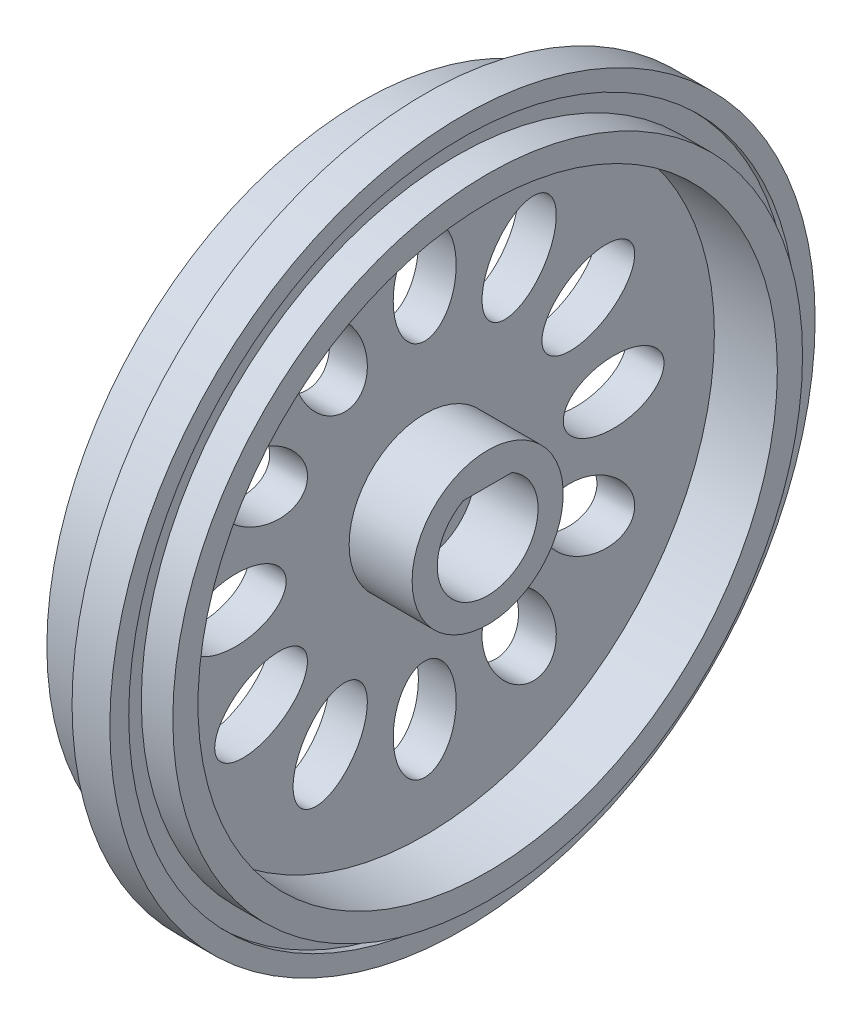
from build123d import *

# Parameters (mm, degrees)
SKETCH2_R           = 23
CUT_EXTRUDE1_DEPTH  = 5
CUT_EXTRUDE2_START  = -2
SKETCH3_R           = 23
CUT_EXTRUDE2_DEPTH  = 2
SKETCH4_R           = 6
BOSS_EXTRUDE2_DEPTH = 5
CUT_EXTRUDE3_DEPTH  = 5
SKETCH6_R           = 1.5
CUT_EXTRUDE4_DEPTH  = 3
SKETCH7_RX          = 4
SKETCH7_RY          = 2.5
CUT_EXTRUDE5_DEPTH  = 3
CIRPATTERN1_COUNT   = 12


with BuildPart() as part:
    # Sketch1 → Revolve1 (revolve)
    with BuildSketch(Plane(origin=(0, 0, 0), x_dir=(1, 0, 0), z_dir=(0, 1, 0)), mode=Mode.PRIVATE) as revolve1_sk:
        Polygon((-5, 25), (0.5, 25), (0.5, 26.5), (0, 26.5), (0, 28), (3, 28), (3, 26.5), (2.5, 26.5), (2.5, 25), (5, 25), (5, 0), (-5, 0), align=None)
    revolve(revolve1_sk.sketch.rotate(Axis((0, 0, 0), (1, 0, 0)), 180), axis=Axis((0, 0, 0), (1, 0, 0)))

    # Sketch2 → Cut-Extrude1 (cut)
    with BuildSketch(Plane(origin=(5, 0, 0), x_dir=(0, 0, -1), z_dir=(1, 0, 0))):
        Circle(SKETCH2_R)
    extrude(amount=-CUT_EXTRUDE1_DEPTH, mode=Mode.SUBTRACT)

    # Sketch3 → Cut-Extrude2 (cut)
    with BuildSketch(Plane.ZY.offset(5).offset(CUT_EXTRUDE2_START)):
        with Locations(Location((0, 0, 0), (0, 0, 180))):
            Circle(SKETCH3_R)
    extrude(amount=CUT_EXTRUDE2_DEPTH, mode=Mode.SUBTRACT)

    # Sketch4 → Boss-Extrude2 (add)
    with BuildSketch(Plane(origin=(0, 0, 0), x_dir=(0, 0, -1), z_dir=(1, 0, 0))):
        with Locations(Location((0, 0, 0), (0, 0, 180))):
            Circle(SKETCH4_R)
    extrude(amount=BOSS_EXTRUDE2_DEPTH)

    # Sketch5 → Cut-Extrude3 (cut)
    with BuildSketch(Plane(origin=(5, 0, 0), x_dir=(0, 0, -1), z_dir=(1, 0, 0))):
        with BuildLine():
            Line((-1.936491673, 3.5), (1.936491673, 3.5))
            ThreePointArc((1.936491673, 3.5), (0, -4), (-1.936491673, 3.5))
        make_face()
    extrude(amount=-CUT_EXTRUDE3_DEPTH, mode=Mode.SUBTRACT)

    # Sketch6 → Cut-Extrude4 (cut)
    with BuildSketch(Plane.ZY.offset(3)):
        Circle(SKETCH6_R)
    extrude(amount=-CUT_EXTRUDE4_DEPTH, mode=Mode.SUBTRACT)

    # Sketch7 → Cut-Extrude5 (cut)
    with BuildSketch(Plane(origin=(0, 0, 0), x_dir=(0, 0, -1), z_dir=(1, 0, 0))):
        with Locations(Location((0, 15), (0, 0, -90))):
            Ellipse(SKETCH7_RX, SKETCH7_RY)
    cut_extrude5 = extrude(amount=-CUT_EXTRUDE5_DEPTH, mode=Mode.SUBTRACT)

    # CirPattern1: Cut-Extrude5 ×12 about axis
    cirpattern1_axis = Axis((4.242640687, 0, 0), (-1, 0, 0))
    for i in range(1, CIRPATTERN1_COUNT):
        add(cut_extrude5.rotate(cirpattern1_axis, i * 360 / CIRPATTERN1_COUNT), mode=Mode.SUBTRACT)


solid = part.part
